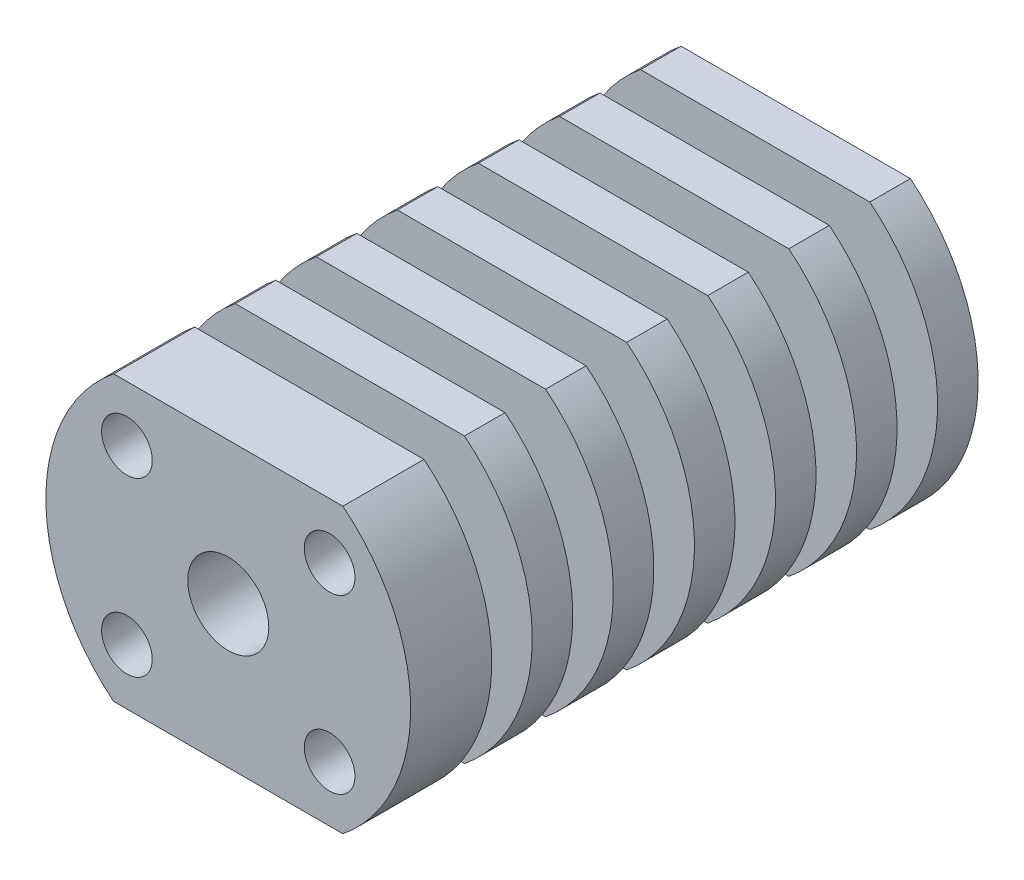
from build123d import *

# Parameters (mm, degrees)
ESTRUSIONE_ESTRUSIONE1_DEPTH = 28
FORO_FILETTATO_M3_1_D        = 2.5
FORO_FILETTATO_M3_1_DEPTH    = 4.5
FORO_FILETTATO_M3_1_TIP      = 0.751075774
SCHIZZO4_R                   = 2
TAGLIO_ESTRUSIONE1_DEPTH     = 31.232432916
SCHIZZO5_W                   = 6
SCHIZZO5_H                   = 2
RIPETIZIONE_A_L1_COUNT       = 7
RIPETIZIONE_A_L1_PITCH       = 4


with BuildPart() as part:
    # Schizzo1 → Estrusione-Estrusione1 (new body)
    with BuildSketch(Plane.XY):
        with BuildLine():
            Line((5.656854249, 7), (-5.656854249, 7))
            ThreePointArc((-5.656854249, 7), (-9, 0), (-5.656854249, -7))
            Line((-5.656854249, -7), (5.656854249, -7))
            ThreePointArc((5.656854249, -7), (8.121320344, -3.878679656), (9, 0))
            ThreePointArc((9, 0), (8.121320344, 3.878679656), (5.656854249, 7))
        make_face()
    extrude(amount=ESTRUSIONE_ESTRUSIONE1_DEPTH)

    # Foro filettato M3-1
    with Locations(Plane(origin=(-5, 4.25, 28), x_dir=(1, 0, 0), z_dir=(0, 0, 1))):
        with Locations((0, 0), (10, 0), (0, -8.5), (10, -8.5)):
            Hole(FORO_FILETTATO_M3_1_D / 2, depth=FORO_FILETTATO_M3_1_DEPTH)
            with Locations((0, 0, -(FORO_FILETTATO_M3_1_DEPTH + FORO_FILETTATO_M3_1_TIP / 2))):  # 118° drill point
                Cone(0, FORO_FILETTATO_M3_1_D / 2, FORO_FILETTATO_M3_1_TIP, mode=Mode.SUBTRACT)

    # Schizzo4 → Taglio-Estrusione1 (cut, through all)
    with BuildSketch(Plane.XY.offset(28)):
        Circle(SCHIZZO4_R)
    extrude(amount=-TAGLIO_ESTRUSIONE1_DEPTH, mode=Mode.SUBTRACT)

    # Schizzo5 → Taglia-Rivoluzione1 (revolve, cut)
    with BuildSketch(Plane(origin=(0, 0, 0), x_dir=(1, 0, 0), z_dir=(0, 1, 0)), mode=Mode.PRIVATE) as taglia_rivoluzione1_sk:
        with Locations((6, -23)):
            Rectangle(SCHIZZO5_W, SCHIZZO5_H)
    taglia_rivoluzione1 = revolve(taglia_rivoluzione1_sk.sketch.rotate(Axis((0, 0, 0), (0, 0, 1)), 180), axis=Axis((0, 0, 0), (0, 0, 1)), mode=Mode.SUBTRACT)

    # Ripetizione a L1: Taglia-Rivoluzione1 ×7
    with Locations(*[(0, 0, -i * RIPETIZIONE_A_L1_PITCH) for i in range(1, RIPETIZIONE_A_L1_COUNT)]):
        add(taglia_rivoluzione1, mode=Mode.SUBTRACT)


solid = part.part
